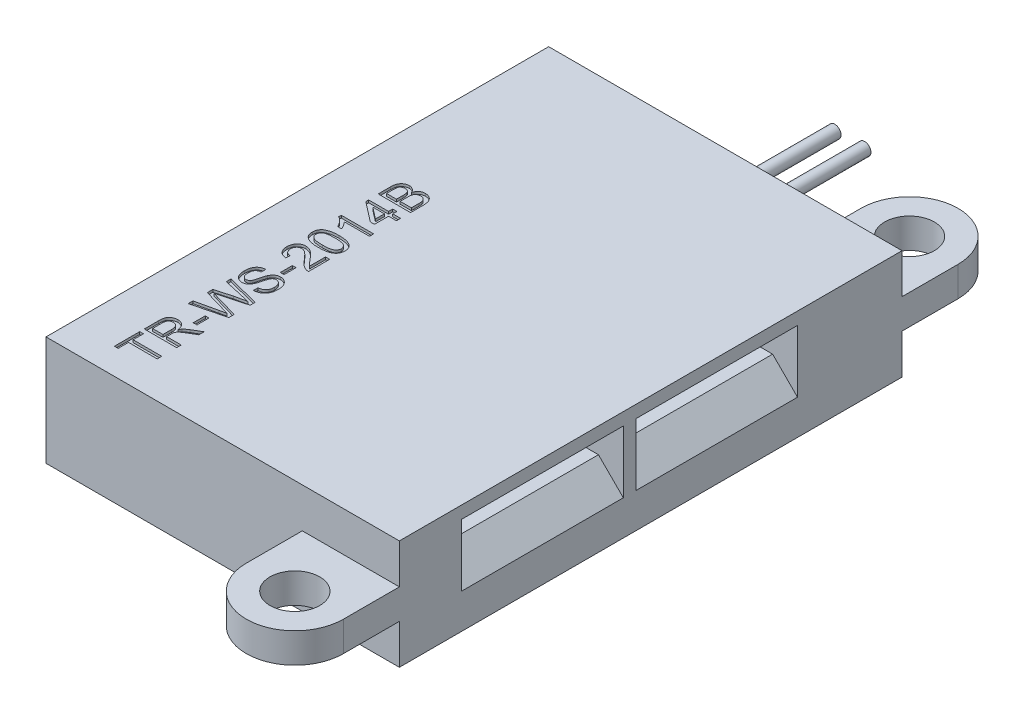
from build123d import *

# Parameters (mm, degrees)
SKETCH1_W                  = 14.2
SKETCH1_H                  = 20.2
BOSS_EXTRUDE1_DEPTH        = 4.4
SKETCH2_R                  = 1
BOSS_EXTRUDE2_DEPTH        = 0.6
SKETCH3_W                  = 6.5
SKETCH3_H                  = 1.5
CUT_EXTRUDE1_DEPTH         = 8
CHAMFER1_SIZE              = 1
LPATTERN1_COUNT            = 2
LPATTERN1_PITCH            = 7
CHAMFER1_OF_LPATTERN1_SIZE = 1
SKETCH4_W                  = 0.15
SKETCH4_H                  = 0.483333333
CUT_EXTRUDE2_DEPTH         = 0.1
SKETCH5_R                  = 0.25
BOSS_EXTRUDE3_DEPTH        = 5


with BuildPart() as part:
    # Sketch1 → Boss-Extrude1 (new body)
    with BuildSketch(Plane(origin=(0, 0, 0), x_dir=(1, 0, 0), z_dir=(0, 1, 0))):
        Rectangle(SKETCH1_W, SKETCH1_H)
    extrude(amount=BOSS_EXTRUDE1_DEPTH)

    # Sketch2 → Boss-Extrude2 (add, symmetric)
    with BuildSketch(Plane(origin=(0, 2.2, 0), x_dir=(1, 0, 0), z_dir=(0, 1, 0))):
        with BuildLine():
            Line((3.2, 10.1), (3.2, 12.35))
            ThreePointArc((3.2, 12.35), (5.15, 14.3), (7.1, 12.35))
            Line((7.1, 12.35), (7.1, 10.1))
            Line((7.1, 10.1), (3.2, 10.1))
        make_face()
        with Locations(Location((5.15, 12.35, 0), (0, 0, 270))):
            Circle(SKETCH2_R, mode=Mode.SUBTRACT)
    boss_extrude2 = extrude(amount=BOSS_EXTRUDE2_DEPTH, both=True)

    # Mirror1: Boss-Extrude2 across plane
    add(boss_extrude2.mirror(Plane.XY))

    # Sketch3 → Cut-Extrude1 (cut)
    with BuildSketch(Plane(origin=(7.1, 0, 0), x_dir=(0, 0, -1), z_dir=(1, 0, 0))):
        with Locations((-4.35, 3.15)):
            Rectangle(SKETCH3_W, SKETCH3_H)
    cut_extrude1 = extrude(amount=-CUT_EXTRUDE1_DEPTH, mode=Mode.SUBTRACT)

    # Chamfer1
    chamfer1_edges = [part.edges().sort_by_distance(p)[0] for p in [
        (7.1, 2.4, 4.35),
    ]]
    chamfer(chamfer1_edges, length=CHAMFER1_SIZE)

    # LPattern1: Cut-Extrude1 ×2
    with Locations(*[(0, 0, -i * LPATTERN1_PITCH) for i in range(1, LPATTERN1_COUNT)]):
        add(cut_extrude1, mode=Mode.SUBTRACT)

    # Chamfer1 of LPattern1
    chamfer1_of_lpattern1_edges = [part.edges().sort_by_distance(p)[0] for p in [
        (7.1, 2.4, -2.65),
    ]]
    chamfer(chamfer1_of_lpattern1_edges, length=CHAMFER1_OF_LPATTERN1_SIZE)

    # Sketch4 → Cut-Extrude2 (cut)
    # profile 1 of 11: a face of its own
    with BuildSketch(Plane(origin=(0, 4.4, 0), x_dir=(1, 0, 0), z_dir=(0, 1, 0))):
        Polygon((-4.1, -8.633333333), (-5.25, -8.633333333), (-5.25, -9.05), (-5.4, -9.05), (-5.4, -8.033333333), (-5.25, -8.033333333), (-5.25, -8.45), (-4.1, -8.45), align=None)
    # profile 2 of 11: a face of its own
    with BuildSketch(Plane(origin=(0, 4.4, 0), x_dir=(1, 0, 0), z_dir=(0, 1, 0))):
        with BuildLine():
            Line((-4.1, -7.85), (-5.4, -7.85))
            Line((-5.4, -7.85), (-5.4, -7.2859375))
            add(Edge.make_bspline(
                [(-5.4, -7.2859375), (-5.39989593, -7.272655555), (-5.399694516, -7.246949906), (-5.398268731, -7.209671407), (-5.395195112, -7.174875665), (-5.391871421, -7.142498702), (-5.386770001, -7.112546272), (-5.380918785, -7.085049276), (-5.373955756, -7.059965253), (-5.365731861, -7.037182093), (-5.356427825, -7.016044201), (-5.344947894, -6.99645129), (-5.332369251, -6.977587368), (-5.317587733, -6.960158248), (-5.301416359, -6.943682394), (-5.283626347, -6.92830409), (-5.264258227, -6.913873334), (-5.236181027, -6.896335208), (-5.198735425, -6.877553641), (-5.150915394, -6.861763083), (-5.100946539, -6.851637502), (-5.066802734, -6.850551172), (-5.049479167, -6.85)],
                knots=[0, 0, 0, 0, 1.24220941, 2.404150919, 3.487574396, 4.508709597, 5.44696429, 6.32753097, 7.137127571, 7.879277215, 8.591472037, 9.293319653, 10.000359801, 10.709261809, 11.426849853, 12.157724323, 12.906240672, 13.683312968, 15.25174676, 16.810062879, 18.38151927, 20, 20, 20, 20], degree=3))
            add(Edge.make_bspline(
                [(-5.049479167, -6.85), (-5.038358758, -6.850254387), (-5.016395188, -6.85075682), (-4.98410286, -6.854605504), (-4.953248842, -6.861569388), (-4.923562905, -6.870499191), (-4.89546571, -6.882721392), (-4.868383143, -6.896880193), (-4.843060055, -6.91442127), (-4.818818972, -6.93405919), (-4.796191095, -6.956583462), (-4.775946462, -6.982169303), (-4.757856515, -7.01068555), (-4.741749046, -7.041854758), (-4.727929879, -7.076056773), (-4.716280285, -7.11297423), (-4.706913903, -7.152876897), (-4.702353334, -7.180524842), (-4.7, -7.194791667)],
                knots=[0, 0, 0, 0, 0.982573534, 1.940650111, 2.867480857, 3.774872843, 4.675300059, 5.57094453, 6.47088154, 7.392140904, 8.325045975, 9.285790227, 10.268842685, 11.304900608, 12.381753303, 13.524349751, 14.722521064, 16, 16, 16, 16], degree=3))
            add(Edge.make_bspline(
                [(-4.7, -7.194791667), (-4.694745653, -7.184305409), (-4.684747799, -7.164352392), (-4.668584851, -7.137095853), (-4.652874811, -7.113524361), (-4.641357268, -7.100077595), (-4.6359375, -7.09375)],
                knots=[0, 0, 0, 0, 1.172465462, 2.230941199, 3.167540489, 4, 4, 4, 4], degree=3))
            add(Edge.make_bspline(
                [(-4.6359375, -7.09375), (-4.623898753, -7.081469226), (-4.599170311, -7.056243644), (-4.55705053, -7.021481696), (-4.51016475, -6.987778794), (-4.476280239, -6.96730174), (-4.458854167, -6.956770833)],
                knots=[0, 0, 0, 0, 0.918110279, 1.885863737, 2.912745394, 4, 4, 4, 4], degree=3))
            Line((-4.458854167, -6.956770833), (-4.1, -6.743489583))
            Line((-4.1, -6.743489583), (-4.1, -6.953645833))
            Line((-4.1, -6.953645833), (-4.374479167, -7.115625))
            add(Edge.make_bspline(
                [(-4.374479167, -7.115625), (-4.384109519, -7.121449075), (-4.402771561, -7.132735175), (-4.430027871, -7.149035618), (-4.455116951, -7.165024753), (-4.478776979, -7.179830635), (-4.500567659, -7.194200515), (-4.520742522, -7.207602378), (-4.539201842, -7.220200729), (-4.56064125, -7.235605679), (-4.584205788, -7.253766747), (-4.608625249, -7.274814652), (-4.628380496, -7.294680587), (-4.647509445, -7.319384327), (-4.665092779, -7.350050292), (-4.673338611, -7.375957904), (-4.67734375, -7.388541667)],
                knots=[0, 0, 0, 0, 1.130771422, 2.191249344, 3.190612492, 4.11972812, 4.995402764, 5.812993556, 6.553242539, 7.240638048, 8.465286352, 9.540898192, 10.478367696, 11.273890495, 12.675882784, 14, 14, 14, 14], degree=3))
            add(Edge.make_bspline(
                [(-4.67734375, -7.388541667), (-4.678296657, -7.393825792), (-4.680472174, -7.405889609), (-4.681893007, -7.426373941), (-4.683401031, -7.451193222), (-4.683357092, -7.469180177), (-4.683333333, -7.47890625)],
                knots=[0, 0, 0, 0, 0.709978628, 1.620902492, 2.713552433, 4, 4, 4, 4], degree=3))
            Line((-4.683333333, -7.47890625), (-4.683333333, -7.666666667))
            Line((-4.683333333, -7.666666667), (-4.1, -7.666666667))
            Line((-4.1, -7.666666667), (-4.1, -7.85))
        make_face()
        with BuildLine():
            Line((-4.833333333, -7.666666667), (-4.833333333, -7.318489583))
            add(Edge.make_bspline(
                [(-4.833333333, -7.318489583), (-4.833603008, -7.301029626), (-4.83410714, -7.268389874), (-4.838509697, -7.222763625), (-4.845314457, -7.183804443), (-4.85581871, -7.150975695), (-4.869825268, -7.123368096), (-4.88662236, -7.099149871), (-4.908079967, -7.079254867), (-4.93222336, -7.062600435), (-4.958761215, -7.049752683), (-4.986646176, -7.040271297), (-5.015718265, -7.034291202), (-5.035561884, -7.033654531), (-5.045572917, -7.033333333)],
                knots=[0, 0, 0, 0, 1.546563792, 2.89115595, 4.057161529, 5.044599167, 5.931992865, 6.792070364, 7.640724426, 8.508981427, 9.382637603, 10.24360869, 11.113907051, 12, 12, 12, 12], degree=3))
            add(Edge.make_bspline(
                [(-5.045572917, -7.033333333), (-5.05287041, -7.033574218), (-5.067164055, -7.03404604), (-5.088136312, -7.036545811), (-5.108010916, -7.041301842), (-5.126931135, -7.047869275), (-5.144938047, -7.056184602), (-5.161960829, -7.066402824), (-5.177912536, -7.078471215), (-5.192871699, -7.092315074), (-5.206485141, -7.108204754), (-5.218230035, -7.126356056), (-5.228210815, -7.146624035), (-5.236132188, -7.169032755), (-5.242468008, -7.193511478), (-5.246683022, -7.220199599), (-5.249732993, -7.248975055), (-5.249909335, -7.268914778), (-5.25, -7.279166667)],
                knots=[0, 0, 0, 0, 0.965235723, 1.89061323, 2.787065514, 3.661873922, 4.534873316, 5.404925039, 6.281839248, 7.175200054, 8.095223355, 9.040740021, 10.02630299, 11.075573487, 12.177989335, 13.364883635, 14.645170704, 16, 16, 16, 16], degree=3))
            Line((-5.25, -7.279166667), (-5.25, -7.666666667))
            Line((-5.25, -7.666666667), (-4.833333333, -7.666666667))
        make_face(mode=Mode.SUBTRACT)
    # profile 3 of 11: a face of its own
    with BuildSketch(Plane(origin=(0, 4.4, 0), x_dir=(1, 0, 0), z_dir=(0, 1, 0))):
        with Locations((-4.558333333, -6.408333333)):
            Rectangle(SKETCH4_W, SKETCH4_H)
    # profile 4 of 11: a face of its own
    with BuildSketch(Plane(origin=(0, 4.4, 0), x_dir=(1, 0, 0), z_dir=(0, 1, 0))):
        with BuildLine():
            Line((-4.1, -5.755208333), (-5.4, -6.083333333))
            Line((-5.4, -6.083333333), (-5.4, -5.894270833))
            Line((-5.4, -5.894270833), (-4.545052083, -5.701302083))
            add(Edge.make_bspline(
                [(-4.545052083, -5.701302083), (-4.500954235, -5.691322207), (-4.413190106, -5.671460125), (-4.325433414, -5.651565209), (-4.281770833, -5.641666667)],
                knots=[0, 0, 0, 0, 1.004917352, 2, 2, 2, 2], degree=3))
            add(Edge.make_bspline(
                [(-4.281770833, -5.641666667), (-4.297472483, -5.637030843), (-4.327114338, -5.628279252), (-4.369134522, -5.616448797), (-4.405808571, -5.605703574), (-4.437307453, -5.596549196), (-4.463675422, -5.589136931), (-4.48458847, -5.582737266), (-4.500456142, -5.578375334), (-4.509204042, -5.575790445), (-4.512760417, -5.574739583)],
                knots=[0, 0, 0, 0, 1.633809233, 3.084334118, 4.356383392, 5.447555203, 6.357852567, 7.089694452, 7.629924063, 8, 8, 8, 8], degree=3))
            Line((-4.512760417, -5.574739583), (-5.4, -5.31796875))
            Line((-5.4, -5.31796875), (-5.4, -5.09765625))
            Line((-5.4, -5.09765625), (-4.748697917, -4.91171875))
            add(Edge.make_bspline(
                [(-4.748697917, -4.91171875), (-4.708463028, -4.901471961), (-4.629128536, -4.881267509), (-4.510956872, -4.854422635), (-4.395652075, -4.829645674), (-4.319390507, -4.815373679), (-4.281770833, -4.808333333)],
                knots=[0, 0, 0, 0, 1.04154457, 2.053700482, 3.039894486, 4, 4, 4, 4], degree=3))
            add(Edge.make_bspline(
                [(-4.281770833, -4.808333333), (-4.300957642, -4.804005351), (-4.341508156, -4.794858342), (-4.405338092, -4.780187349), (-4.475627374, -4.764671322), (-4.524483477, -4.753665026), (-4.55, -4.747916667)],
                knots=[0, 0, 0, 0, 0.858435927, 1.814268333, 2.85843797, 4, 4, 4, 4], degree=3))
            Line((-4.55, -4.747916667), (-5.4, -4.555989583))
            Line((-5.4, -4.555989583), (-5.4, -4.366666667))
            Line((-5.4, -4.366666667), (-4.1, -4.694270833))
            Line((-4.1, -4.694270833), (-4.1, -4.8953125))
            Line((-4.1, -4.8953125), (-5.093489583, -5.167447917))
            add(Edge.make_bspline(
                [(-5.093489583, -5.167447917), (-5.103213555, -5.17013251), (-5.121707463, -5.175238305), (-5.147887572, -5.182571631), (-5.171180607, -5.188802065), (-5.191414807, -5.194239093), (-5.208602749, -5.198925877), (-5.222751176, -5.202834604), (-5.23382369, -5.20601626), (-5.2402746, -5.20765072), (-5.24296875, -5.208333333)],
                knots=[0, 0, 0, 0, 1.562262602, 2.971248911, 4.210443623, 5.296361544, 6.216026566, 6.969452752, 7.569603555, 8, 8, 8, 8], degree=3))
            add(Edge.make_bspline(
                [(-5.24296875, -5.208333333), (-5.225946758, -5.213166382), (-5.193703407, -5.222321226), (-5.148369104, -5.235653757), (-5.108588237, -5.24711639), (-5.084026706, -5.254249772), (-5.07265625, -5.257552083)],
                knots=[0, 0, 0, 0, 1.197732026, 2.268764715, 3.198546125, 4, 4, 4, 4], degree=3))
            Line((-5.07265625, -5.257552083), (-4.1, -5.5390625))
            Line((-4.1, -5.5390625), (-4.1, -5.755208333))
        make_face()
    # profile 5 of 11: a face of its own
    with BuildSketch(Plane(origin=(0, 4.4, 0), x_dir=(1, 0, 0), z_dir=(0, 1, 0))):
        with BuildLine():
            Line((-4.55, -4.316666667), (-4.55, -4.133333333))
            add(Edge.make_bspline(
                [(-4.55, -4.133333333), (-4.533538255, -4.131318476), (-4.501914357, -4.127447826), (-4.457107111, -4.116593441), (-4.416841564, -4.102753869), (-4.380674612, -4.085140114), (-4.348613951, -4.06255343), (-4.319872328, -4.034891754), (-4.294870965, -4.001570698), (-4.273149693, -3.963597366), (-4.255274975, -3.921791525), (-4.242494333, -3.876827154), (-4.234814805, -3.829344032), (-4.233834098, -3.79681711), (-4.233333333, -3.780208333)],
                knots=[0, 0, 0, 0, 1.125663117, 2.162459464, 3.124651064, 4.013251417, 4.885106576, 5.777454667, 6.711412587, 7.70453926, 8.742726144, 9.79152362, 10.8723159, 12, 12, 12, 12], degree=3))
            add(Edge.make_bspline(
                [(-4.233333333, -3.780208333), (-4.233614161, -3.76551426), (-4.234161722, -3.736863662), (-4.240414076, -3.69535946), (-4.249889408, -3.65644223), (-4.263433322, -3.620542731), (-4.280124176, -3.588123649), (-4.299863146, -3.559699087), (-4.322550866, -3.535672795), (-4.34833384, -3.516772065), (-4.375376619, -3.501938809), (-4.403167145, -3.491053505), (-4.431559324, -3.484570129), (-4.450662779, -3.483743919), (-4.46015625, -3.483333333)],
                knots=[0, 0, 0, 0, 1.267273291, 2.470937522, 3.613914644, 4.718809661, 5.774390768, 6.753382426, 7.696630629, 8.61218657, 9.50073524, 10.352250004, 11.181149856, 12, 12, 12, 12], degree=3))
            add(Edge.make_bspline(
                [(-4.46015625, -3.483333333), (-4.469555094, -3.48376868), (-4.487925122, -3.484619564), (-4.51472292, -3.490276532), (-4.539343021, -3.500771291), (-4.562588676, -3.514652091), (-4.583837491, -3.533731508), (-4.603080708, -3.558145368), (-4.620860575, -3.587849432), (-4.630555972, -3.610114555), (-4.635677083, -3.621875)],
                knots=[0, 0, 0, 0, 0.941839432, 1.840823827, 2.725902505, 3.611878027, 4.542122039, 5.568946669, 6.71591688, 8, 8, 8, 8], degree=3))
            add(Edge.make_bspline(
                [(-4.635677083, -3.621875), (-4.637556508, -3.626454974), (-4.641802469, -3.636801967), (-4.647424403, -3.654535935), (-4.654688583, -3.675581064), (-4.662194731, -3.700434394), (-4.670024849, -3.729024845), (-4.679414618, -3.761105306), (-4.688817429, -3.796958319), (-4.69901216, -3.835338275), (-4.709280637, -3.874118693), (-4.7197262, -3.911093114), (-4.729786295, -3.945269609), (-4.739969773, -3.976609496), (-4.75008049, -4.005166146), (-4.759984246, -4.030951228), (-4.769444698, -4.0540076), (-4.776401867, -4.068089285), (-4.7796875, -4.074739583)],
                knots=[0, 0, 0, 0, 0.499206867, 1.127798999, 1.875456396, 2.745236412, 3.745989836, 4.865816661, 6.11691742, 7.484780673, 8.871821359, 10.163659874, 11.360539719, 12.465442435, 13.487424717, 14.416003165, 15.251932479, 16, 16, 16, 16], degree=3))
            add(Edge.make_bspline(
                [(-4.7796875, -4.074739583), (-4.787958141, -4.090035414), (-4.803922631, -4.119560347), (-4.832420174, -4.159422002), (-4.864355527, -4.192730605), (-4.899078328, -4.219931365), (-4.936271506, -4.241073933), (-4.975929446, -4.255525106), (-5.017498128, -4.265274347), (-5.046123757, -4.26619739), (-5.060677083, -4.266666667)],
                knots=[0, 0, 0, 0, 1.158648043, 2.236492264, 3.255730763, 4.224764102, 5.168065908, 6.094744354, 7.03136427, 8, 8, 8, 8], degree=3))
            add(Edge.make_bspline(
                [(-5.060677083, -4.266666667), (-5.076793367, -4.266047132), (-5.108848538, -4.264814883), (-5.155894364, -4.253910274), (-5.201208441, -4.23642495), (-5.237277698, -4.216703993), (-5.26450971, -4.197421529), (-5.283848057, -4.181224162), (-5.301938559, -4.163353539), (-5.318788684, -4.143967549), (-5.334175605, -4.12285845), (-5.348710612, -4.100525029), (-5.361204906, -4.076165837), (-5.377106885, -4.041936985), (-5.392986638, -3.996147234), (-5.406823772, -3.938503574), (-5.414972186, -3.87783554), (-5.41609385, -3.836482779), (-5.416666667, -3.815364583)],
                knots=[0, 0, 0, 0, 1.19987574, 2.38654414, 3.578474407, 4.812047981, 5.438556365, 6.063157668, 6.689933248, 7.332048586, 7.975173567, 8.635638291, 9.315743449, 10.013439258, 11.447896523, 12.918278233, 14.426213869, 16, 16, 16, 16], degree=3))
            add(Edge.make_bspline(
                [(-5.416666667, -3.815364583), (-5.416146183, -3.792247024), (-5.415132702, -3.747232682), (-5.406428484, -3.681883632), (-5.392147084, -3.620790278), (-5.375505075, -3.57302244), (-5.358910076, -3.537559717), (-5.345540128, -3.512562554), (-5.330471363, -3.489280553), (-5.31451637, -3.467269626), (-5.296636348, -3.44731506), (-5.277769155, -3.428597847), (-5.257560637, -3.411413894), (-5.228625086, -3.391055856), (-5.19022372, -3.369069293), (-5.140433973, -3.350231999), (-5.087961252, -3.337143885), (-5.051726625, -3.334616351), (-5.033333333, -3.333333333)],
                knots=[0, 0, 0, 0, 1.607284738, 3.12969308, 4.575034728, 5.965153243, 6.637705521, 7.296846459, 7.934914134, 8.565222986, 9.185417795, 9.795898322, 10.412763716, 11.027557596, 12.254905276, 13.478103208, 14.719843788, 16, 16, 16, 16], degree=3))
            Line((-5.033333333, -3.333333333), (-5.033333333, -3.516666667))
            add(Edge.make_bspline(
                [(-5.033333333, -3.516666667), (-5.042642077, -3.517831638), (-5.060856531, -3.520111143), (-5.087225817, -3.525764432), (-5.111712238, -3.53369603), (-5.134563344, -3.542963531), (-5.155537233, -3.554313172), (-5.175005704, -3.567262471), (-5.192375993, -3.58250736), (-5.208280266, -3.599273747), (-5.222125601, -3.618201089), (-5.23411532, -3.63918261), (-5.244356277, -3.662182532), (-5.25225301, -3.687412069), (-5.258810082, -3.714537259), (-5.263517052, -3.743869188), (-5.265955345, -3.775305601), (-5.266425383, -3.79695809), (-5.266666667, -3.808072917)],
                knots=[0, 0, 0, 0, 1.074143617, 2.101780708, 3.08272149, 4.018756036, 4.921684117, 5.809545323, 6.690533959, 7.562671613, 8.451478506, 9.368903006, 10.325822098, 11.328733099, 12.392103336, 13.519840867, 14.726865076, 16, 16, 16, 16], degree=3))
            add(Edge.make_bspline(
                [(-5.266666667, -3.808072917), (-5.26658063, -3.819626383), (-5.266414084, -3.841991053), (-5.263327169, -3.874315682), (-5.259159495, -3.904298192), (-5.252784522, -3.931764844), (-5.245191036, -3.957010785), (-5.235225864, -3.979635719), (-5.223775339, -4.000005205), (-5.210419504, -4.01774105), (-5.195754833, -4.033118984), (-5.180264076, -4.046473372), (-5.164250865, -4.058026609), (-5.147224484, -4.067226043), (-5.129654386, -4.07462654), (-5.111213181, -4.079414555), (-5.092224776, -4.082800645), (-5.07926923, -4.083153317), (-5.07265625, -4.083333333)],
                knots=[0, 0, 0, 0, 1.463767833, 2.83349453, 4.11258735, 5.297695043, 6.404355811, 7.448943226, 8.424740201, 9.359993028, 10.255029373, 11.113120303, 11.949635862, 12.752249867, 13.561398762, 14.359474769, 15.162616536, 16, 16, 16, 16], degree=3))
            add(Edge.make_bspline(
                [(-5.07265625, -4.083333333), (-5.061471621, -4.082859557), (-5.039763289, -4.08194), (-5.008922291, -4.072549984), (-4.980808724, -4.058108074), (-4.965512276, -4.043880491), (-4.9578125, -4.03671875)],
                knots=[0, 0, 0, 0, 1.050964922, 2.039826012, 3.013306874, 4, 4, 4, 4], degree=3))
            add(Edge.make_bspline(
                [(-4.9578125, -4.03671875), (-4.95396452, -4.032204065), (-4.945454951, -4.022220117), (-4.934193532, -4.003643444), (-4.922815306, -3.980611124), (-4.911504456, -3.952969263), (-4.900123742, -3.920765399), (-4.888405631, -3.884051572), (-4.876768517, -3.842687521), (-4.865549347, -3.797935613), (-4.854304, -3.752720114), (-4.843036222, -3.709769409), (-4.832564664, -3.670246698), (-4.821652949, -3.634538282), (-4.812083868, -3.602053592), (-4.801979857, -3.573437259), (-4.792810692, -3.54817501), (-4.786338647, -3.532704576), (-4.783333333, -3.525520833)],
                knots=[0, 0, 0, 0, 0.523895241, 1.15856198, 1.91379747, 2.794786646, 3.797548623, 4.933673981, 6.202125154, 7.596592219, 9.013381566, 10.322253347, 11.523322902, 12.62839848, 13.623936171, 14.517279059, 15.31149399, 16, 16, 16, 16], degree=3))
            add(Edge.make_bspline(
                [(-4.783333333, -3.525520833), (-4.779025857, -3.516172337), (-4.770571004, -3.497822806), (-4.756099459, -3.471854297), (-4.741179641, -3.44748136), (-4.72485403, -3.425444178), (-4.708251861, -3.404860268), (-4.690453255, -3.386440981), (-4.672029954, -3.369558976), (-4.652288669, -3.355048318), (-4.632063657, -3.342013667), (-4.611062724, -3.330608912), (-4.589164864, -3.321425667), (-4.566633378, -3.31337149), (-4.543217828, -3.307578204), (-4.519154677, -3.303035105), (-4.494330835, -3.30038519), (-4.477523522, -3.300129507), (-4.469010417, -3.3)],
                knots=[0, 0, 0, 0, 1.198939608, 2.35331753, 3.461943082, 4.526118786, 5.546665844, 6.541063461, 7.507917594, 8.45466906, 9.391808034, 10.310478591, 11.234866782, 12.156150758, 13.095742909, 14.042062018, 15.008281039, 16, 16, 16, 16], degree=3))
            add(Edge.make_bspline(
                [(-4.469010417, -3.3), (-4.452023305, -3.30068917), (-4.418213433, -3.302060841), (-4.368451755, -3.313523833), (-4.320332273, -3.331916597), (-4.282157072, -3.353204437), (-4.252954921, -3.373407654), (-4.231964013, -3.390373768), (-4.212555192, -3.409189702), (-4.194119713, -3.429390478), (-4.177034215, -3.451133483), (-4.161291571, -3.474601594), (-4.146732811, -3.499548325), (-4.12897223, -3.535166682), (-4.110528617, -3.582530214), (-4.094531376, -3.642676458), (-4.085052243, -3.70629497), (-4.083914335, -3.749880943), (-4.083333333, -3.772135417)],
                knots=[0, 0, 0, 0, 1.196987384, 2.382393894, 3.582009067, 4.820735309, 5.454243406, 6.085350439, 6.72189866, 7.359035515, 8.013098289, 8.67027723, 9.350744424, 10.048966745, 11.475869723, 12.9268444, 14.430883741, 16, 16, 16, 16], degree=3))
            add(Edge.make_bspline(
                [(-4.083333333, -3.772135417), (-4.083461453, -3.786288229), (-4.083712422, -3.814011567), (-4.086324848, -3.854780669), (-4.09090486, -3.89374941), (-4.096312754, -3.931135972), (-4.104314427, -3.966543403), (-4.113579833, -4.000341041), (-4.124833854, -4.032306985), (-4.137476401, -4.062692134), (-4.15231031, -4.091162525), (-4.168250599, -4.11833993), (-4.186390467, -4.143624736), (-4.206033668, -4.167478338), (-4.227287549, -4.189935193), (-4.250624859, -4.21045857), (-4.275442452, -4.229607248), (-4.301935243, -4.246971147), (-4.329766599, -4.262478271), (-4.358461722, -4.276436926), (-4.388171258, -4.288118928), (-4.418826009, -4.297745759), (-4.450286643, -4.305626037), (-4.482762772, -4.311244909), (-4.516050645, -4.31532386), (-4.538616706, -4.31621642), (-4.55, -4.316666667)],
                knots=[0, 0, 0, 0, 1.25996057, 2.468082768, 3.634780732, 4.752960275, 5.829306256, 6.864378612, 7.871400872, 8.844610325, 9.791691919, 10.727448286, 11.647433253, 12.558807848, 13.47716826, 14.396893492, 15.322832279, 16.265995594, 17.214085728, 18.157755542, 19.104963261, 20.053336853, 21.016800397, 21.990101907, 22.986120736, 24, 24, 24, 24], degree=3))
        make_face()
    # profile 6 of 11: a face of its own
    with BuildSketch(Plane(origin=(0, 4.4, 0), x_dir=(1, 0, 0), z_dir=(0, 1, 0))):
        with Locations((-4.558333333, -2.908333334)):
            Rectangle(SKETCH4_W, SKETCH4_H)
    # profile 7 of 11: a face of its own
    with BuildSketch(Plane(origin=(0, 4.4, 0), x_dir=(1, 0, 0), z_dir=(0, 1, 0))):
        with BuildLine():
            Line((-4.266666667, -1.7), (-4.1, -1.7))
            Line((-4.1, -1.7), (-4.1, -2.55))
            add(Edge.make_bspline(
                [(-4.1, -2.55), (-4.109906178, -2.550023111), (-4.129598937, -2.550069054), (-4.158838189, -2.546653134), (-4.187716609, -2.541505385), (-4.206304152, -2.535542308), (-4.215625, -2.532552083)],
                knots=[0, 0, 0, 0, 1.010600758, 2.009000657, 3.001600101, 4, 4, 4, 4], degree=3))
            add(Edge.make_bspline(
                [(-4.215625, -2.532552083), (-4.230863509, -2.527051982), (-4.261818481, -2.515879268), (-4.306442669, -2.492901392), (-4.351060143, -2.466389763), (-4.38729416, -2.440227925), (-4.416227901, -2.416374268), (-4.438860108, -2.396360593), (-4.462028328, -2.374184503), (-4.48572644, -2.349860502), (-4.510108478, -2.323623643), (-4.535255596, -2.295437849), (-4.560699195, -2.26497037), (-4.577564269, -2.243700878), (-4.586197917, -2.2328125)],
                knots=[0, 0, 0, 0, 1.204682444, 2.447149603, 3.728063212, 5.065745198, 5.768097617, 6.518745349, 7.313897871, 8.154576377, 9.046034033, 9.979646649, 10.965731253, 12, 12, 12, 12], degree=3))
            add(Edge.make_bspline(
                [(-4.586197917, -2.2328125), (-4.600276962, -2.216085264), (-4.627387057, -2.18387591), (-4.66761591, -2.138391229), (-4.704970731, -2.096848467), (-4.74010601, -2.059908755), (-4.7726817, -2.027271226), (-4.802621626, -1.998855238), (-4.829839783, -1.974428875), (-4.855298097, -1.954251393), (-4.879332671, -1.93736086), (-4.902647091, -1.922696184), (-4.92605773, -1.910923855), (-4.949120004, -1.900821428), (-4.971924985, -1.892983872), (-4.99467694, -1.887468007), (-5.017160493, -1.883903663), (-5.032192201, -1.883521328), (-5.039583333, -1.883333333)],
                knots=[0, 0, 0, 0, 1.782511555, 3.432339066, 4.950556168, 6.337242158, 7.588364383, 8.709771971, 9.70247892, 10.569050646, 11.3564271, 12.096888545, 12.812232926, 13.490631961, 14.148641375, 14.7751826, 15.397753892, 16, 16, 16, 16], degree=3))
            add(Edge.make_bspline(
                [(-5.039583333, -1.883333333), (-5.046889435, -1.883514272), (-5.061223609, -1.883869264), (-5.082201293, -1.887238109), (-5.102404425, -1.891926278), (-5.121464038, -1.899511508), (-5.139964334, -1.908519991), (-5.157302574, -1.920192023), (-5.174133806, -1.933403922), (-5.189577895, -1.948838165), (-5.204047993, -1.96558019), (-5.216154936, -1.984208537), (-5.226624519, -2.003805889), (-5.235415955, -2.024570832), (-5.24178915, -2.046811204), (-5.246440625, -2.070245089), (-5.249383241, -2.094891733), (-5.249791297, -2.111710438), (-5.25, -2.1203125)],
                knots=[0, 0, 0, 0, 0.987973548, 1.938350371, 2.870100611, 3.788647624, 4.708095761, 5.649791829, 6.611214459, 7.599816467, 8.600146238, 9.60047601, 10.599079585, 11.604913276, 12.645813302, 13.724097821, 14.835971573, 16, 16, 16, 16], degree=3))
            add(Edge.make_bspline(
                [(-5.25, -2.1203125), (-5.249792321, -2.129348728), (-5.249385879, -2.14703329), (-5.246431635, -2.172884742), (-5.241907017, -2.197421113), (-5.235028112, -2.220607306), (-5.226245393, -2.242293422), (-5.215670106, -2.2627349), (-5.203234764, -2.281780036), (-5.1886249, -2.299159177), (-5.172392039, -2.314862828), (-5.154722112, -2.328794411), (-5.135224996, -2.340299027), (-5.114275847, -2.349594929), (-5.092005849, -2.357256354), (-5.068193814, -2.362748925), (-5.042870825, -2.365755272), (-5.025528162, -2.366358459), (-5.016666667, -2.366666667)],
                knots=[0, 0, 0, 0, 1.130801575, 2.213061782, 3.252933619, 4.249917472, 5.234510032, 6.17726912, 7.126517163, 8.075267631, 9.012689889, 9.949419277, 10.884824487, 11.837981854, 12.813782694, 13.828488442, 14.890433304, 16, 16, 16, 16], degree=3))
            Line((-5.016666667, -2.366666667), (-5.033333333, -2.533333333))
            add(Edge.make_bspline(
                [(-5.033333333, -2.533333333), (-5.047858762, -2.531628123), (-5.076116732, -2.528310783), (-5.117043294, -2.52004725), (-5.155118026, -2.508447799), (-5.190865779, -2.49456198), (-5.223699209, -2.477176761), (-5.254276934, -2.457411002), (-5.281839217, -2.434372348), (-5.30686502, -2.408734325), (-5.328584789, -2.380232849), (-5.347865094, -2.349545332), (-5.363936856, -2.316314048), (-5.377265204, -2.280856177), (-5.387372107, -2.243066196), (-5.394621234, -2.203004299), (-5.39908929, -2.160604163), (-5.399692098, -2.13152147), (-5.4, -2.116666667)],
                knots=[0, 0, 0, 0, 1.130730993, 2.199739822, 3.223355253, 4.205635214, 5.160465258, 6.091399258, 7.016214058, 7.932437584, 8.856204186, 9.781944312, 10.73064304, 11.705670886, 12.707145581, 13.751268262, 14.851396981, 16, 16, 16, 16], degree=3))
            add(Edge.make_bspline(
                [(-5.4, -2.116666667), (-5.399742584, -2.101634052), (-5.399241135, -2.072350431), (-5.394110306, -2.029679489), (-5.386119089, -1.989418273), (-5.374981775, -1.951419198), (-5.36037745, -1.91590673), (-5.34253421, -1.882853688), (-5.321626344, -1.85210717), (-5.297401996, -1.824182741), (-5.27095963, -1.798997288), (-5.242730695, -1.776944856), (-5.212811556, -1.758398981), (-5.181585991, -1.742905158), (-5.148631226, -1.731059416), (-5.114194733, -1.722941506), (-5.078219082, -1.717358154), (-5.053667873, -1.716900227), (-5.041145833, -1.716666667)],
                knots=[0, 0, 0, 0, 1.195413282, 2.328672114, 3.413490698, 4.457927086, 5.473612634, 6.462365753, 7.441157041, 8.42539015, 9.397434444, 10.3422866, 11.269742116, 12.193178192, 13.110630063, 14.048592791, 15.004708964, 16, 16, 16, 16], degree=3))
            add(Edge.make_bspline(
                [(-5.041145833, -1.716666667), (-5.02828098, -1.717024119), (-5.002522883, -1.717739813), (-4.96402779, -1.723352314), (-4.92600731, -1.732862919), (-4.88795022, -1.745747795), (-4.849537604, -1.762891009), (-4.810453975, -1.78492509), (-4.770536302, -1.812006565), (-4.736813725, -1.838327538), (-4.708381638, -1.862586278), (-4.684979071, -1.884269201), (-4.659835912, -1.909053922), (-4.632661888, -1.936586736), (-4.604083989, -1.967553209), (-4.573320134, -2.001225654), (-4.541144755, -2.038305081), (-4.519165612, -2.064047009), (-4.5078125, -2.07734375)],
                knots=[0, 0, 0, 0, 0.927158598, 1.856363277, 2.797335015, 3.749167701, 4.749227661, 5.825023649, 6.979171586, 8.223362362, 8.906844726, 9.672958766, 10.52256342, 11.451810239, 12.461281865, 13.559912207, 14.739596516, 16, 16, 16, 16], degree=3))
            add(Edge.make_bspline(
                [(-4.5078125, -2.07734375), (-4.498569383, -2.088752618), (-4.480909164, -2.110550795), (-4.454937232, -2.141151404), (-4.431776754, -2.169102046), (-4.411097675, -2.194058379), (-4.392483431, -2.215818138), (-4.376149146, -2.234392643), (-4.3623728, -2.250120383), (-4.340909051, -2.273605543), (-4.310283649, -2.303252994), (-4.280780692, -2.325361116), (-4.266666667, -2.3359375)],
                knots=[0, 0, 0, 0, 1.242067915, 2.373138023, 3.395138797, 4.312776638, 5.114836229, 5.81737152, 6.405241861, 6.883397567, 8.50903741, 10, 10, 10, 10], degree=3))
            Line((-4.266666667, -2.3359375), (-4.266666667, -1.7))
        make_face()
    # profile 8 of 11: a face of its own
    with BuildSketch(Plane(origin=(0, 4.4, 0), x_dir=(1, 0, 0), z_dir=(0, 1, 0))):
        with BuildLine():
            add(Edge.make_bspline(
                [(-4.741145833, -1.516666667), (-4.759724018, -1.516498705), (-4.796110858, -1.516169738), (-4.84935149, -1.514130448), (-4.899911362, -1.510566675), (-4.947749056, -1.505257976), (-4.993048412, -1.49892386), (-5.035688467, -1.490809266), (-5.075717945, -1.481550266), (-5.1129821, -1.470571536), (-5.147877321, -1.458318535), (-5.180467846, -1.444605575), (-5.210745342, -1.429126016), (-5.238923826, -1.412549614), (-5.26480348, -1.394555225), (-5.288431263, -1.375165598), (-5.309883417, -1.35434726), (-5.32891012, -1.331883734), (-5.345712967, -1.30799042), (-5.360294686, -1.282731708), (-5.37271518, -1.255928393), (-5.38244571, -1.227504097), (-5.390277512, -1.197735702), (-5.396067069, -1.16650535), (-5.399473426, -1.133757381), (-5.399822492, -1.11137958), (-5.4, -1.1)],
                knots=[0, 0, 0, 0, 1.514579231, 2.966422906, 4.342888004, 5.645649548, 6.889653673, 8.070797339, 9.183112822, 10.237837631, 11.23608981, 12.196917133, 13.117904763, 14.006315217, 14.860292005, 15.684850496, 16.495566347, 17.293863258, 18.081168691, 18.873799386, 19.668575398, 20.485475899, 21.319695627, 22.176102692, 23.072510053, 24, 24, 24, 24], degree=3))
            add(Edge.make_bspline(
                [(-5.4, -1.1), (-5.399517276, -1.083302132), (-5.398568945, -1.050498499), (-5.390593632, -1.002670812), (-5.377569089, -0.957437821), (-5.359300475, -0.91516478), (-5.336321021, -0.876215571), (-5.307981256, -0.841716508), (-5.275317301, -0.811464122), (-5.23753034, -0.786185018), (-5.195747932, -0.764068797), (-5.149747349, -0.744426972), (-5.099590273, -0.726669628), (-5.054692082, -0.714069038), (-5.015934509, -0.705080953), (-4.983968338, -0.69913157), (-4.949476666, -0.694192384), (-4.91254293, -0.690408302), (-4.873208556, -0.687303551), (-4.831449054, -0.684905895), (-4.787160053, -0.683688838), (-4.756771446, -0.683454057), (-4.741145833, -0.683333333)],
                knots=[0, 0, 0, 0, 1.134369906, 2.228515181, 3.285355733, 4.326599491, 5.350616376, 6.348601676, 7.350764122, 8.365406289, 9.429174435, 10.560286681, 11.762070813, 13.043401781, 13.727542782, 14.465843617, 15.252693982, 16.095180924, 16.988916914, 17.934437918, 18.937902156, 20, 20, 20, 20], degree=3))
            add(Edge.make_bspline(
                [(-4.741145833, -0.683333333), (-4.722654908, -0.683504409), (-4.686529245, -0.68383864), (-4.633715592, -0.68582371), (-4.583536891, -0.68960054), (-4.535877316, -0.694244795), (-4.490867153, -0.701282355), (-4.448387796, -0.708813879), (-4.408583365, -0.718252587), (-4.371316713, -0.729195359), (-4.336360113, -0.741416494), (-4.303661411, -0.754880066), (-4.273309261, -0.770061045), (-4.245187056, -0.786669339), (-4.219293352, -0.804747194), (-4.195440183, -0.823966366), (-4.173963442, -0.844870627), (-4.15496981, -0.867414853), (-4.137861179, -0.891148233), (-4.123212339, -0.916541239), (-4.111076076, -0.943483165), (-4.100700161, -0.971793883), (-4.093097302, -1.00176068), (-4.087277432, -1.03314723), (-4.083850271, -1.066069182), (-4.083508023, -1.088533679), (-4.083333333, -1.1)],
                knots=[0, 0, 0, 0, 1.509004079, 2.9481365, 4.311841541, 5.615149582, 6.854413858, 8.028470806, 9.134999426, 10.19077436, 11.196702255, 12.155743144, 13.07445799, 13.963752978, 14.818580019, 15.649443378, 16.460966408, 17.260058134, 18.052243746, 18.845663614, 19.647670084, 20.461076897, 21.302979722, 22.167206202, 23.06450606, 24, 24, 24, 24], degree=3))
            add(Edge.make_bspline(
                [(-4.083333333, -1.1), (-4.08376217, -1.115033676), (-4.084598283, -1.144345206), (-4.090279155, -1.187152534), (-4.100277757, -1.227329496), (-4.113687293, -1.265214959), (-4.131623319, -1.300383082), (-4.153445997, -1.333001777), (-4.178647599, -1.363726495), (-4.198531085, -1.381413511), (-4.20859375, -1.390364583)],
                knots=[0, 0, 0, 0, 1.10322584, 2.150986741, 3.161425019, 4.136713905, 5.093944212, 6.049774532, 7.013026876, 8, 8, 8, 8], degree=3))
            add(Edge.make_bspline(
                [(-4.20859375, -1.390364583), (-4.22345582, -1.400667473), (-4.254102045, -1.421912474), (-4.3063567, -1.446777904), (-4.36388174, -1.468958309), (-4.427805797, -1.48636586), (-4.497620109, -1.500000312), (-4.573461666, -1.50984779), (-4.655297703, -1.515420493), (-4.711883799, -1.516241898), (-4.741145833, -1.516666667)],
                knots=[0, 0, 0, 0, 0.779365345, 1.607084704, 2.489375761, 3.438383567, 4.461919411, 5.557722155, 6.737039282, 8, 8, 8, 8], degree=3))
        make_face()
        with BuildLine():
            add(Edge.make_bspline(
                [(-4.741666667, -1.35), (-4.716662938, -1.349834513), (-4.668800272, -1.349517735), (-4.600420194, -1.346208171), (-4.538732031, -1.340510894), (-4.483821192, -1.332978721), (-4.435613401, -1.323033203), (-4.394231505, -1.310545428), (-4.359178828, -1.296468736), (-4.33088982, -1.279049097), (-4.307830153, -1.259976516), (-4.287998093, -1.240285379), (-4.271141296, -1.219512423), (-4.257086165, -1.197793188), (-4.246444543, -1.174790684), (-4.238731472, -1.150756441), (-4.234292718, -1.125685228), (-4.233654953, -1.108610593), (-4.233333333, -1.1)],
                knots=[0, 0, 0, 0, 1.89448813, 3.626469325, 5.185477471, 6.587276848, 7.82441448, 8.910550357, 9.859733512, 10.6775885, 11.416198291, 12.123144072, 12.791880183, 13.439617036, 14.078171869, 14.70637855, 15.347637704, 16, 16, 16, 16], degree=3))
            add(Edge.make_bspline(
                [(-4.233333333, -1.1), (-4.233661896, -1.091391493), (-4.234313429, -1.074320995), (-4.238655539, -1.049192872), (-4.246761055, -1.025248332), (-4.25738256, -1.002294529), (-4.271079674, -0.980315612), (-4.288309096, -0.959827291), (-4.308080946, -0.939915445), (-4.331403998, -0.92104622), (-4.359682957, -0.903511596), (-4.394757897, -0.889461497), (-4.436132134, -0.876962463), (-4.484259745, -0.867049471), (-4.539075493, -0.859463728), (-4.600595173, -0.853808), (-4.668886467, -0.850474112), (-4.716662764, -0.850162883), (-4.741666667, -0.85)],
                knots=[0, 0, 0, 0, 0.652578524, 1.294050225, 1.924494109, 2.563260593, 3.207694917, 3.880813851, 4.587993952, 5.331957758, 6.150083828, 7.099581593, 8.186077474, 9.42362516, 10.819375359, 12.378900244, 14.104883934, 16, 16, 16, 16], degree=3))
            add(Edge.make_bspline(
                [(-4.741666667, -0.85), (-4.766150259, -0.85015783), (-4.813059895, -0.850460228), (-4.880122628, -0.853877869), (-4.940775381, -0.85923362), (-4.99507407, -0.866559437), (-5.042959746, -0.876295447), (-5.084534351, -0.888103898), (-5.11970922, -0.902175433), (-5.148837687, -0.918906439), (-5.172730932, -0.937531395), (-5.193412614, -0.956986928), (-5.211001711, -0.977759427), (-5.225111944, -1.000216919), (-5.236495555, -1.023635557), (-5.244330047, -1.04855344), (-5.249143313, -1.074725647), (-5.249711175, -1.092687293), (-5.25, -1.101822917)],
                knots=[0, 0, 0, 0, 1.850066095, 3.544656626, 5.0727657, 6.45041401, 7.682899467, 8.762389858, 9.712573485, 10.538438529, 11.291566246, 11.996865408, 12.681389046, 13.341983376, 13.996294293, 14.643563182, 15.31009126, 16, 16, 16, 16], degree=3))
            add(Edge.make_bspline(
                [(-5.25, -1.101822917), (-5.249776373, -1.110434078), (-5.249335409, -1.127414185), (-5.245048362, -1.152256169), (-5.238049923, -1.175905812), (-5.227954475, -1.198205725), (-5.21543008, -1.21937664), (-5.200196648, -1.239444248), (-5.181785404, -1.257927406), (-5.167991486, -1.269051105), (-5.1609375, -1.274739583)],
                knots=[0, 0, 0, 0, 1.021462953, 2.014194051, 2.982449609, 3.941891643, 4.91211921, 5.897280499, 6.924703483, 8, 8, 8, 8], degree=3))
            add(Edge.make_bspline(
                [(-5.1609375, -1.274739583), (-5.150580983, -1.280934347), (-5.128710198, -1.294016385), (-5.090696695, -1.308648972), (-5.047178727, -1.321625162), (-4.997619468, -1.332164389), (-4.942086979, -1.339962945), (-4.880669827, -1.346002882), (-4.813140717, -1.349170752), (-4.766148681, -1.349715957), (-4.741666667, -1.35)],
                knots=[0, 0, 0, 0, 0.671109831, 1.417242661, 2.260125669, 3.199948126, 4.23589883, 5.382398214, 6.636276086, 8, 8, 8, 8], degree=3))
        make_face(mode=Mode.SUBTRACT)
    # profile 9 of 11: a face of its own
    with BuildSketch(Plane(origin=(0, 4.4, 0), x_dir=(1, 0, 0), z_dir=(0, 1, 0))):
        with BuildLine():
            Line((-4.1, 0.066666667), (-4.1, -0.1))
            Line((-4.1, -0.1), (-5.113020833, -0.1))
            add(Edge.make_bspline(
                [(-5.113020833, -0.1), (-5.103769817, -0.109599486), (-5.084542592, -0.129550967), (-5.057287625, -0.163179561), (-5.029999136, -0.20097075), (-5.003474646, -0.242015009), (-4.978169801, -0.283724964), (-4.95575942, -0.324252301), (-4.936733006, -0.362603773), (-4.926340841, -0.387874066), (-4.921354167, -0.4)],
                knots=[0, 0, 0, 0, 0.893410138, 1.856855062, 2.898678959, 4.017251132, 5.132047586, 6.168690112, 7.121247105, 8, 8, 8, 8], degree=3))
            Line((-4.921354167, -0.4), (-5.075, -0.4))
            add(Edge.make_bspline(
                [(-5.075, -0.4), (-5.085731211, -0.379177578), (-5.106881792, -0.338137818), (-5.143341264, -0.280043564), (-5.183248203, -0.226081027), (-5.225827676, -0.176570915), (-5.269441814, -0.132418631), (-5.313175173, -0.094919741), (-5.355928853, -0.063789666), (-5.38574426, -0.048118099), (-5.4, -0.040625)],
                knots=[0, 0, 0, 0, 1.141359047, 2.249551097, 3.338622382, 4.409719606, 5.42990334, 6.36011437, 7.215916014, 8, 8, 8, 8], degree=3))
            Line((-5.4, -0.040625), (-5.4, 0.066666667))
            Line((-5.4, 0.066666667), (-4.1, 0.066666667))
        make_face()
    # profile 10 of 11: a face of its own
    with BuildSketch(Plane(origin=(0, 4.4, 0), x_dir=(1, 0, 0), z_dir=(0, 1, 0))):
        Polygon((-4.1, 0.983333333), (-4.416666667, 0.983333333), (-4.416666667, 0.416666667), (-4.583333333, 0.416666667), (-5.383333333, 1.033333333), (-5.383333333, 1.15), (-4.583333333, 1.15), (-4.583333333, 1.316666667), (-4.416666667, 1.316666667), (-4.416666667, 1.15), (-4.1, 1.15), align=None)
        Polygon((-4.583333333, 0.983333333), (-5.0515625, 0.983333333), (-4.583333333, 0.622395833), align=None, mode=Mode.SUBTRACT)
    # profile 11 of 11: a face of its own
    with BuildSketch(Plane(origin=(0, 4.4, 0), x_dir=(1, 0, 0), z_dir=(0, 1, 0))):
        with BuildLine():
            Line((-4.1, 1.55), (-5.4, 1.55))
            Line((-5.4, 1.55), (-5.4, 2.03671875))
            add(Edge.make_bspline(
                [(-5.4, 2.03671875), (-5.399953487, 2.048788516), (-5.399862726, 2.072340061), (-5.39760609, 2.106731085), (-5.394505222, 2.139298629), (-5.390556807, 2.17012784), (-5.384657979, 2.199012353), (-5.378083469, 2.226125924), (-5.369908258, 2.251335259), (-5.357637493, 2.282218491), (-5.338666575, 2.317773127), (-5.310442193, 2.356007307), (-5.276251151, 2.388863799), (-5.237532857, 2.41650927), (-5.195812724, 2.43872634), (-5.152365804, 2.454759628), (-5.108022002, 2.464930032), (-5.078004283, 2.466088442), (-5.063020833, 2.466666667)],
                knots=[0, 0, 0, 0, 0.939498507, 1.83322867, 2.681897829, 3.486672795, 4.251434503, 4.975927433, 5.657710531, 6.312810905, 7.561503051, 8.78340726, 9.997379925, 11.237114968, 12.476665788, 13.665547382, 14.834749792, 16, 16, 16, 16], degree=3))
            add(Edge.make_bspline(
                [(-5.063020833, 2.466666667), (-5.049079391, 2.466061265), (-5.021330915, 2.464856299), (-4.980468397, 2.455229981), (-4.940810422, 2.440159691), (-4.902950941, 2.418467303), (-4.867104001, 2.391330883), (-4.835022823, 2.357229521), (-4.806423362, 2.317188752), (-4.791189035, 2.287119852), (-4.783333333, 2.271614583)],
                knots=[0, 0, 0, 0, 0.926794087, 1.844653005, 2.778994443, 3.741202323, 4.738235586, 5.759634266, 6.84473753, 8, 8, 8, 8], degree=3))
            add(Edge.make_bspline(
                [(-4.783333333, 2.271614583), (-4.780331049, 2.281205338), (-4.774453087, 2.299982404), (-4.763696796, 2.326975962), (-4.751450911, 2.352316291), (-4.737687734, 2.376050968), (-4.722307146, 2.398046907), (-4.705225862, 2.418096406), (-4.687039188, 2.436756485), (-4.667169618, 2.453400847), (-4.6460492, 2.468233615), (-4.623958286, 2.481271081), (-4.6009595, 2.492270653), (-4.577050277, 2.501129744), (-4.552263781, 2.508242755), (-4.526460806, 2.513129386), (-4.499719225, 2.516027564), (-4.481604449, 2.516451274), (-4.472395833, 2.516666667)],
                knots=[0, 0, 0, 0, 1.127307071, 2.207075445, 3.256908754, 4.282608941, 5.282408985, 6.263870425, 7.234983269, 8.202720022, 9.167413107, 10.127917746, 11.077645759, 12.02382113, 12.985756818, 13.967604811, 14.966835385, 16, 16, 16, 16], degree=3))
            add(Edge.make_bspline(
                [(-4.472395833, 2.516666667), (-4.457613213, 2.51621496), (-4.428312262, 2.515319623), (-4.385254441, 2.508222877), (-4.343889289, 2.49603747), (-4.304767608, 2.479494095), (-4.268549201, 2.459554677), (-4.236011811, 2.437315375), (-4.208162845, 2.412382808), (-4.184490811, 2.385039148), (-4.16454732, 2.354808859), (-4.147198533, 2.32140897), (-4.132803995, 2.284331781), (-4.120748543, 2.243579629), (-4.111443827, 2.198719116), (-4.104846597, 2.149378778), (-4.100586611, 2.095300249), (-4.100201002, 2.057647581), (-4.1, 2.038020833)],
                knots=[0, 0, 0, 0, 1.028330587, 2.038276349, 3.026510127, 4.022742207, 4.987888112, 5.899430057, 6.75924801, 7.58151675, 8.409137447, 9.27369529, 10.195744353, 11.172390338, 12.227965724, 13.380380624, 14.634502938, 16, 16, 16, 16], degree=3))
            Line((-4.1, 2.038020833), (-4.1, 1.55))
        make_face()
        with BuildLine():
            Line((-4.85, 1.733333333), (-4.85, 2.001302083))
            add(Edge.make_bspline(
                [(-4.85, 2.001302083), (-4.850034692, 2.010070688), (-4.850101343, 2.026917158), (-4.851030657, 2.05121779), (-4.851823495, 2.073646109), (-4.853813456, 2.094115358), (-4.855762535, 2.112726945), (-4.858386299, 2.129406387), (-4.861342686, 2.144235382), (-4.864084957, 2.153315178), (-4.865364583, 2.157552083)],
                knots=[0, 0, 0, 0, 1.335841395, 2.566453063, 3.705076039, 4.753984432, 5.69893722, 6.555639608, 7.326018133, 8, 8, 8, 8], degree=3))
            add(Edge.make_bspline(
                [(-4.865364583, 2.157552083), (-4.868851912, 2.167507238), (-4.875574751, 2.186698692), (-4.890842667, 2.212417893), (-4.909165277, 2.23431998), (-4.930860824, 2.252361593), (-4.955761454, 2.266142667), (-4.983411178, 2.276578599), (-5.014282265, 2.282075586), (-5.035744628, 2.282903815), (-5.046875, 2.283333333)],
                knots=[0, 0, 0, 0, 1.058963388, 2.041459808, 2.989631347, 3.919899374, 4.862262268, 5.840402388, 6.880033636, 8, 8, 8, 8], degree=3))
            add(Edge.make_bspline(
                [(-5.046875, 2.283333333), (-5.057575269, 2.282999464), (-5.078428859, 2.28234879), (-5.108780578, 2.276791089), (-5.137063183, 2.267355736), (-5.163162702, 2.254480181), (-5.186135003, 2.237978925), (-5.206048343, 2.218577627), (-5.221104031, 2.195204758), (-5.230504153, 2.173373755), (-5.236382964, 2.153735038), (-5.239861516, 2.1361891), (-5.242926358, 2.116286593), (-5.245532019, 2.093962239), (-5.247554242, 2.069207525), (-5.249160767, 2.041946199), (-5.249842858, 2.012243147), (-5.249946315, 1.991666826), (-5.25, 1.980989583)],
                knots=[0, 0, 0, 0, 1.216068086, 2.369976461, 3.493683542, 4.597268122, 5.665547116, 6.698540011, 7.738863855, 8.804266032, 9.391389623, 10.067014162, 10.836237155, 11.681038179, 12.622079446, 13.660200056, 14.785856327, 16, 16, 16, 16], degree=3))
            Line((-5.25, 1.980989583), (-5.25, 1.733333333))
            Line((-5.25, 1.733333333), (-4.85, 1.733333333))
        make_face(mode=Mode.SUBTRACT)
        with BuildLine():
            Line((-4.25, 1.733333333), (-4.25, 2.040885417))
            add(Edge.make_bspline(
                [(-4.25, 2.040885417), (-4.249971379, 2.053128719), (-4.249918786, 2.075627125), (-4.251446055, 2.106345197), (-4.252762739, 2.131272997), (-4.255190149, 2.145758639), (-4.25625, 2.152083333)],
                knots=[0, 0, 0, 0, 1.317202051, 2.420502769, 3.310362904, 4, 4, 4, 4], degree=3))
            add(Edge.make_bspline(
                [(-4.25625, 2.152083333), (-4.258157319, 2.161157621), (-4.261850382, 2.178727789), (-4.270092969, 2.203497415), (-4.279535093, 2.226208376), (-4.291535699, 2.246462708), (-4.305363039, 2.265222143), (-4.322643966, 2.281508739), (-4.342299339, 2.296622426), (-4.36488394, 2.309394847), (-4.389621489, 2.320133314), (-4.41642388, 2.328084117), (-4.445172626, 2.332384722), (-4.464917232, 2.333012667), (-4.475, 2.333333333)],
                knots=[0, 0, 0, 0, 1.067698777, 2.067340877, 3.003877398, 3.896034939, 4.774344843, 5.679862112, 6.622203941, 7.625991775, 8.661044271, 9.724611217, 10.838051383, 12, 12, 12, 12], degree=3))
            add(Edge.make_bspline(
                [(-4.475, 2.333333333), (-4.486836564, 2.332973599), (-4.509919072, 2.332272081), (-4.543282766, 2.325636952), (-4.574268819, 2.314576722), (-4.602512026, 2.299248532), (-4.627837827, 2.280293124), (-4.648992287, 2.257177901), (-4.666029937, 2.230529135), (-4.679360604, 2.199867931), (-4.688863024, 2.164054517), (-4.695304341, 2.122072739), (-4.699462521, 2.073259831), (-4.699813167, 2.038377748), (-4.7, 2.019791667)],
                knots=[0, 0, 0, 0, 0.961566064, 1.875151983, 2.752549789, 3.62736036, 4.478590523, 5.312795546, 6.160536385, 7.03915408, 8.020336805, 9.164452039, 10.489146263, 12, 12, 12, 12], degree=3))
            Line((-4.7, 2.019791667), (-4.7, 1.733333333))
            Line((-4.7, 1.733333333), (-4.25, 1.733333333))
        make_face(mode=Mode.SUBTRACT)
    extrude(amount=-CUT_EXTRUDE2_DEPTH, mode=Mode.SUBTRACT)


with BuildPart() as body_2:
    # Sketch5 → Boss-Extrude3 (new body)
    with BuildSketch(Plane(origin=(0, 0, -10.1), x_dir=(-1, 0, 0), z_dir=(0, 0, -1))):
        with Locations((0.6, 2.2)):
            Circle(SKETCH5_R)
    extrude(amount=BOSS_EXTRUDE3_DEPTH)


with BuildPart() as body_3:
    # Mirror3: mirrored copy
    add(body_2.part.mirror(Plane(origin=(0, 0, 0), x_dir=(0, 0, 1), z_dir=(1, 0, 0))))


solid = Compound([part.part, body_2.part, body_3.part])
